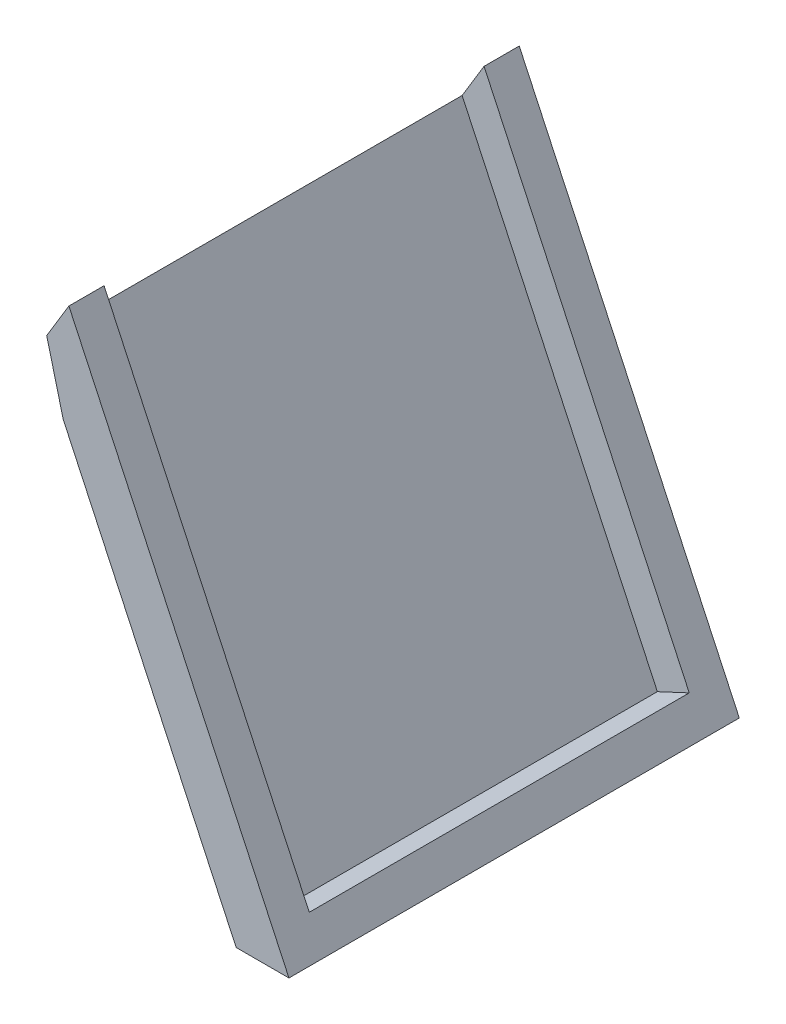
from build123d import *

# Parameters (mm, degrees)
BOSS_EXTRUDE1_DEPTH = 64
BOSS_EXTRUDE2_DEPTH = 4
SKETCH4_W           = 54
SKETCH4_H           = 69
CUT_EXTRUDE1_DEPTH  = 5


with BuildPart() as part:
    # Sketch1 → Boss-Extrude1 (new body)
    with BuildSketch(Plane.XY):
        Polygon((0, 0), (7.5, 0), (-23.773751369, 67.066776241), (-26.927291044, 61.861401656), (-24.579993125, 52.711965363), align=None)
    extrude(amount=-BOSS_EXTRUDE1_DEPTH)

    # Sketch3 → Boss-Extrude2 (add)
    with BuildSketch(Plane(origin=(-10.373887242, -2.661432153, 0), x_dir=(0, 0, 1), z_dir=(-0.9686310353512481, -0.24850335481511932, 0))):
        Polygon((-36, 57.166656338), (-32, 57.166656338), (-28, 57.166656338), (-28, 60.166656338), (-36, 60.166656338), align=None)
    extrude(amount=BOSS_EXTRUDE2_DEPTH)

    # Sketch4 → Cut-Extrude1 (cut)
    with BuildSketch(Plane(origin=(6.160453536, 2.872666662, 0), x_dir=(0, 0, -1), z_dir=(0.9063077870366478, 0.4226182617407043, 0))):
        with Locations((32, 36.330363037)):
            Rectangle(SKETCH4_W, SKETCH4_H)
    extrude(amount=-CUT_EXTRUDE1_DEPTH, mode=Mode.SUBTRACT)


solid = part.part
